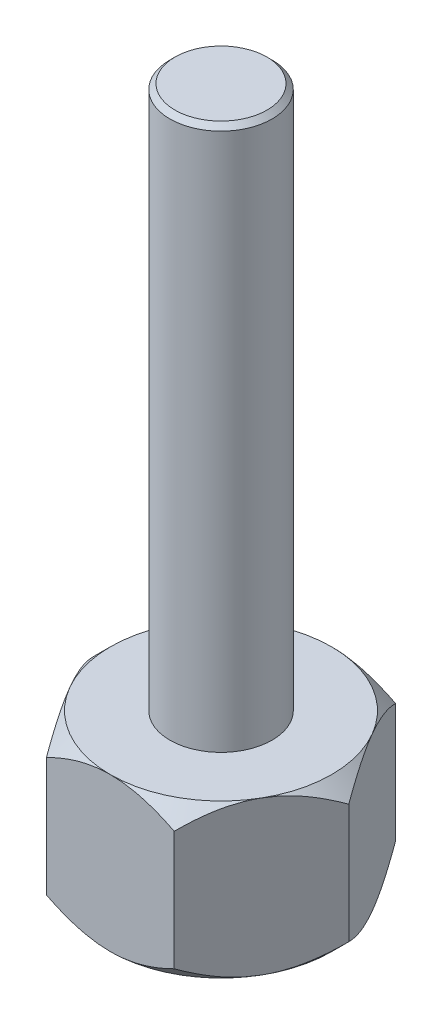
from build123d import *

# Parameters (mm, degrees)
BOSS_EXTRUDE1_DEPTH = 6
SKETCH1_3_R         = 2
BOSS_EXTRUDE2_DEPTH = 27.25
SKETCH2_OUTSIDE_W   = 76.14
SKETCH2_OUTSIDE_H   = 74.8
SKETCH2_OUTSIDE_R   = 4.330127019
CUT_EXTRUDE5_DEPTH  = 29.041264237
CUT_EXTRUDE5_DRAFT  = -45
CHAMFER1_SIZE       = 0.2
SKETCH3_OUTSIDE_W   = 64.57
SKETCH3_OUTSIDE_H   = 63.23
SKETCH3_OUTSIDE_R   = 4.330127019
CUT_EXTRUDE6_DEPTH  = 23.255617268
CUT_EXTRUDE6_DRAFT  = -45


with BuildPart() as part:
    # Sketch1 → Boss-Extrude1 (new body)
    with BuildSketch(Plane(origin=(0, 0, 0), x_dir=(1, 0, 0), z_dir=(0, 1, 0))):
        Polygon((-2.5, -4.330127019), (2.5, -4.330127019), (5, 0), (2.5, 4.330127019), (-2.5, 4.330127019), (-5, 0), align=None)
    extrude(amount=BOSS_EXTRUDE1_DEPTH)

    # Sketch1<3> → Boss-Extrude2 (add)
    with BuildSketch(Plane(origin=(0, 0, 0), x_dir=(1, 0, 0), z_dir=(0, 1, 0))):
        Circle(SKETCH1_3_R)
    extrude(amount=BOSS_EXTRUDE2_DEPTH)


with BuildPart() as cut_extrude5_tool:
    # Sketch2 outside → Cut-Extrude5 (with draft: the straight prism first)
    with BuildSketch(Plane.XZ):
        Rectangle(SKETCH2_OUTSIDE_W, SKETCH2_OUTSIDE_H)
        Circle(SKETCH2_OUTSIDE_R, mode=Mode.SUBTRACT)
    extrude(amount=-CUT_EXTRUDE5_DEPTH)
    # Cut-Extrude5: the draft: its side faces are tilted about the plane it starts from
    cut_extrude5_sides = [cut_extrude5_tool.faces().sort_by_distance(p)[0] for p in [
        (0, 14.520632118, -37.4),
        (38.07, 14.520632118, 0),
        (0, 14.520632118, 37.4),
        (-38.07, 14.520632118, 0),
        (-4.330127019, 14.520632118, 0),
    ]]
    draft(cut_extrude5_sides, Plane.XZ, CUT_EXTRUDE5_DRAFT)


with BuildPart() as part_1:
    add(part.part)

    # Cut-Extrude5: cut by cut_extrude5_tool
    add(cut_extrude5_tool.part, mode=Mode.SUBTRACT)

    # Chamfer1
    chamfer1_edges = [part_1.edges().sort_by_distance(p)[0] for p in [
        (-2, 27.25, 0),
    ]]
    chamfer(chamfer1_edges, length=CHAMFER1_SIZE)


with BuildPart() as cut_extrude6_tool:
    # Sketch3 outside → Cut-Extrude6 (with draft: the straight prism first)
    with BuildSketch(Plane(origin=(0, 6, 0), x_dir=(1, 0, 0), z_dir=(0, 1, 0))):
        Rectangle(SKETCH3_OUTSIDE_W, SKETCH3_OUTSIDE_H)
        Circle(SKETCH3_OUTSIDE_R, mode=Mode.SUBTRACT)
    extrude(amount=-CUT_EXTRUDE6_DEPTH)
    # Cut-Extrude6: the draft: its side faces are tilted about the plane it starts from
    cut_extrude6_sides = [cut_extrude6_tool.faces().sort_by_distance(p)[0] for p in [
        (0, -5.627808634, 31.615),
        (32.285, -5.627808634, 0),
        (0, -5.627808634, -31.615),
        (-32.285, -5.627808634, 0),
        (-4.330127019, -5.627808634, 0),
    ]]
    draft(cut_extrude6_sides, Plane(origin=(0, 6, 0), x_dir=(1, 0, 0), z_dir=(0, 1, 0)), CUT_EXTRUDE6_DRAFT)


with BuildPart() as part_2:
    add(part_1.part)

    # Cut-Extrude6: cut by cut_extrude6_tool
    add(cut_extrude6_tool.part, mode=Mode.SUBTRACT)


solid = part_2.part
